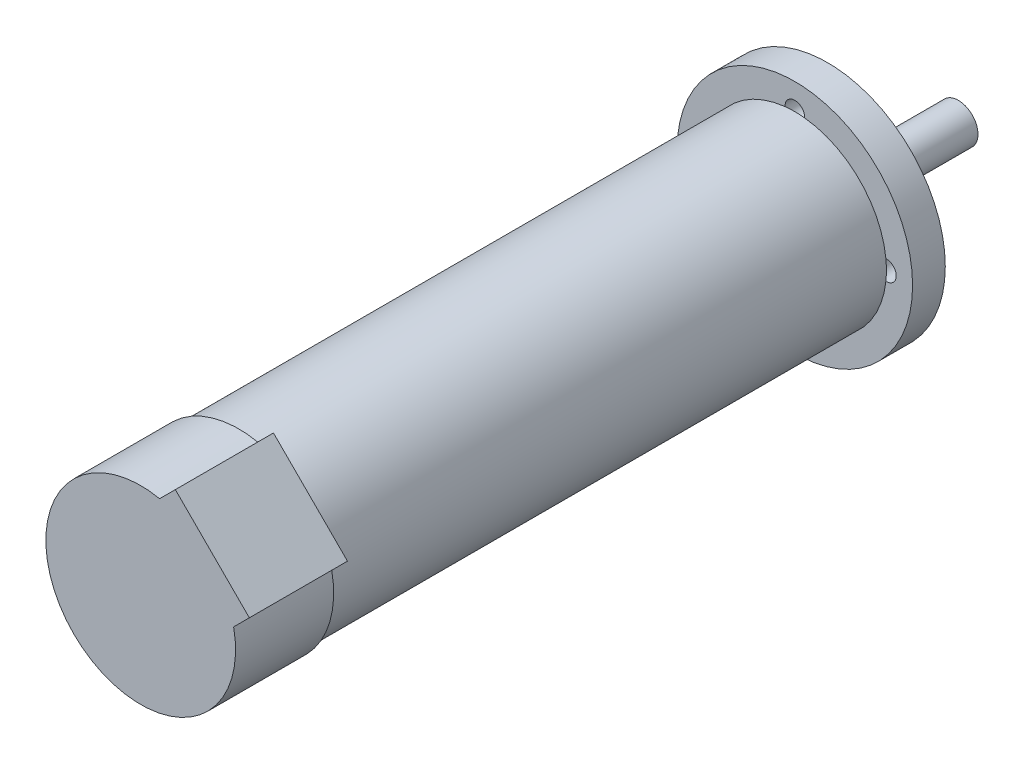
from build123d import *

# Parameters (mm, degrees)
SKETCH1_R           = 18
BOSS_EXTRUDE1_DEPTH = 5
SKETCH2_R           = 14
BOSS_EXTRUDE2_DEPTH = 100
BOSS_EXTRUDE3_DEPTH = 15
SKETCH4_R           = 1.5
CUT_EXTRUDE1_DEPTH  = 5
SKETCH5_R           = 3
BOSS_EXTRUDE4_DEPTH = 20


with BuildPart() as part:
    # Sketch1 → Boss-Extrude1 (new body)
    with BuildSketch(Plane.XY):
        Circle(SKETCH1_R)
    extrude(amount=BOSS_EXTRUDE1_DEPTH)

    # Sketch2 → Boss-Extrude2 (add)
    with BuildSketch(Plane.XY.offset(5)):
        Circle(SKETCH2_R)
    extrude(amount=BOSS_EXTRUDE2_DEPTH)

    # Sketch3 → Boss-Extrude3 (add)
    with BuildSketch(Plane.XY.offset(105)):
        with BuildLine():
            Line((16.609319779, 5.29561128), (5.29561128, 16.609319779))
            Line((5.29561128, 16.609319779), (2.894461439, 14.208169938))
            ThreePointArc((2.894461439, 14.208169938), (-10.253048327, -10.253048327), (14.208169938, 2.894461439))
            Line((14.208169938, 2.894461439), (16.609319779, 5.29561128))
        make_face()
    extrude(amount=-BOSS_EXTRUDE3_DEPTH)

    # Sketch4 → Cut-Extrude1 (cut)
    with BuildSketch(Plane(origin=(0, 0, 0), x_dir=(-1, 0, 0), z_dir=(0, 0, -1))):
        with Locations((0, 14)):
            Circle(SKETCH4_R)
        with Locations((14, 0)):
            Circle(SKETCH4_R)
        with Locations((0, -14)):
            Circle(SKETCH4_R)
        with Locations((-14, 0)):
            Circle(SKETCH4_R)
    extrude(amount=-CUT_EXTRUDE1_DEPTH, mode=Mode.SUBTRACT)

    # Sketch5 → Boss-Extrude4 (add)
    with BuildSketch(Plane(origin=(0, 0, 0), x_dir=(-1, 0, 0), z_dir=(0, 0, -1))):
        with Locations(Location((0, 0, 0), (0, 0, 180))):
            Circle(SKETCH5_R)
    extrude(amount=BOSS_EXTRUDE4_DEPTH)


solid = part.part
